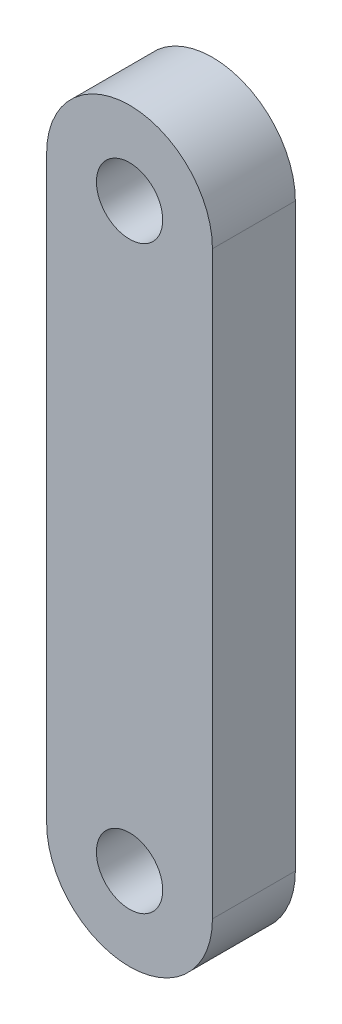
from build123d import *

# Parameters (mm, degrees)
BOSS_EXTRUDE1_DEPTH   = 5
F_4_0MM_DOWEL_HOLE1_D = 4


with BuildPart() as part:
    # Sketch1 → Boss-Extrude1 (new body)
    with BuildSketch(Plane.XY):
        with BuildLine():
            Line((5, 17.5), (5, -17.5))
            ThreePointArc((5, -17.5), (0, -22.5), (-5, -17.5))
            Line((-5, -17.5), (-5, 17.5))
            ThreePointArc((-5, 17.5), (0, 22.5), (5, 17.5))
        make_face()
    extrude(amount=BOSS_EXTRUDE1_DEPTH)

    # Ø4.0mm Dowel Hole1 (through all)
    with Locations(Plane.XY.offset(5)):
        with Locations((0, 17.5), (0, -17.5)):
            Hole(F_4_0MM_DOWEL_HOLE1_D / 2)


solid = part.part
